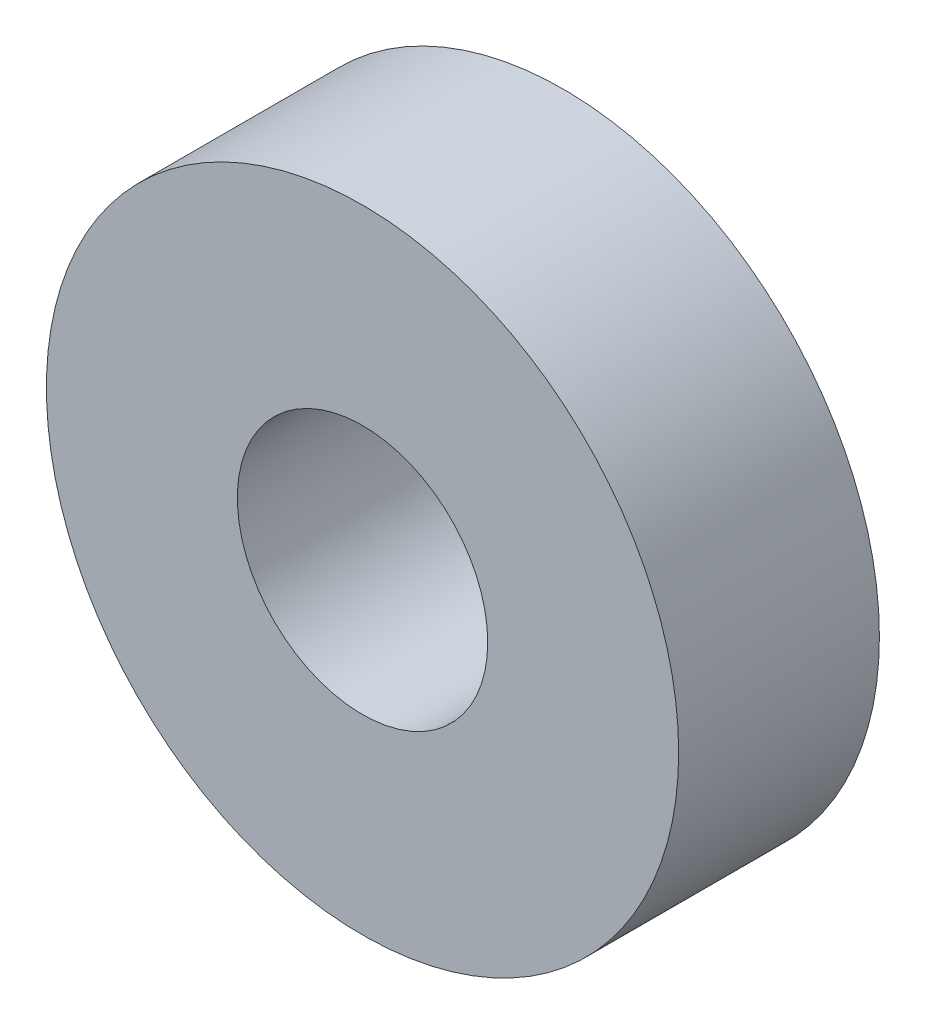
from build123d import *

# Parameters (mm, degrees)
ESQUISSE1_R        = 10
ESQUISSE1_R_2      = 3.96
BOSS_EXTRU_1_DEPTH = 6.35


with BuildPart() as part:
    # Esquisse1 → Boss.-Extru.1 (new body)
    with BuildSketch(Plane.XY):
        Circle(ESQUISSE1_R)
        Circle(ESQUISSE1_R_2, mode=Mode.SUBTRACT)
    extrude(amount=BOSS_EXTRU_1_DEPTH)


solid = part.part
